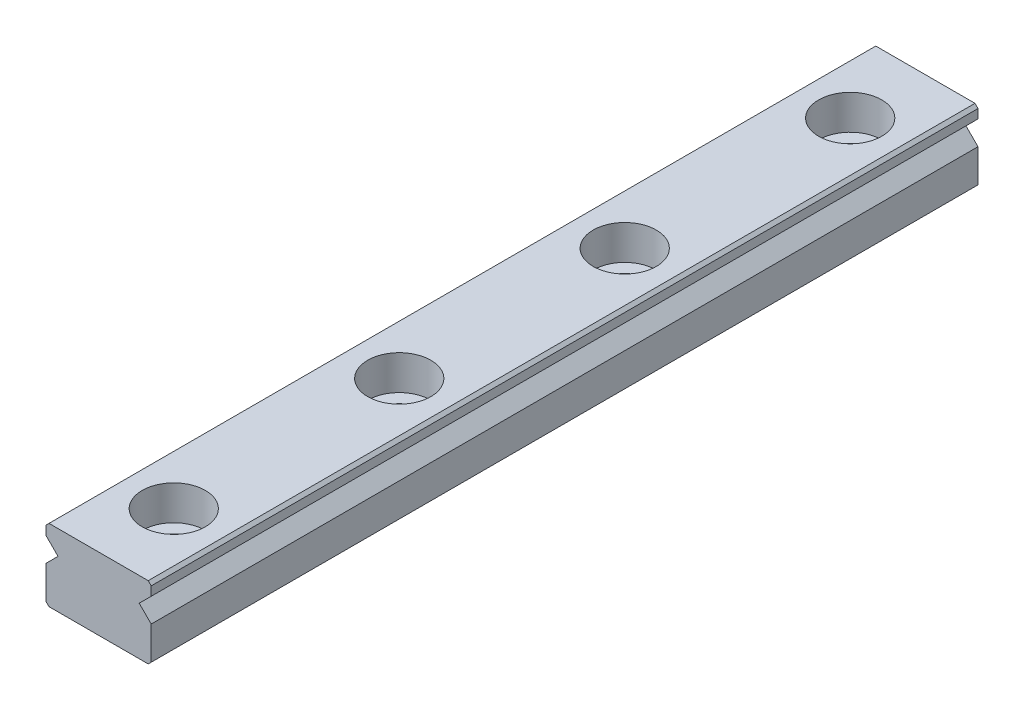
from build123d import *

# Parameters (mm, degrees)
EXTRUDE_1_DEPTH     = 55
SKETCH_2_R          = 2.1
CUT_EXTRUDE_1_DEPTH = 2.3
CHAMFER_1_SIZE      = 0.2
SKETCH_4_R          = 1.2
CUT_EXTRUDE_3_DEPTH = 56.167925464


with BuildPart() as part:
    # 草图1 → 凸台-拉伸1 (new body)
    with BuildSketch(Plane.XY):
        Polygon((-3.5, 0), (3.5, 0), (3.5, 2.4), (2.7, 3.2), (3.5, 4), (3.5, 4.8), (-3.5, 4.8), (-3.5, 4), (-2.7, 3.2), (-3.5, 2.4), align=None)
    extrude(amount=EXTRUDE_1_DEPTH)

    # 草图2 → 切除-拉伸1 (cut)
    with BuildSketch(Plane(origin=(0, 4.8, 0), x_dir=(1, 0, 0), z_dir=(0, 1, 0))):
        with Locations(Location((0, -5, 0), (0, 0, 180))):
            Circle(SKETCH_2_R)
        with Locations(Location((0, -20, 0), (0, 0, 180))):
            Circle(SKETCH_2_R)
        with Locations(Location((0, -35, 0), (0, 0, 180))):
            Circle(SKETCH_2_R)
        with Locations(Location((0, -50, 0), (0, 0, 180))):
            Circle(SKETCH_2_R)
    extrude(amount=-CUT_EXTRUDE_1_DEPTH, mode=Mode.SUBTRACT)

    # 倒角1
    chamfer_1_edges = [part.edges().sort_by_distance(p)[0] for p in [
        (-3.5, 4.8, 27.5),
        (3.5, 4.8, 27.5),
        (3.5, 0, 27.5),
        (-3.5, 0, 27.5),
    ]]
    chamfer(chamfer_1_edges, length=CHAMFER_1_SIZE)

    # 草图4 → 切除-拉伸3 (cut, through all)
    with BuildSketch(Plane(origin=(0, 2.5, 0), x_dir=(1, 0, 0), z_dir=(0, 1, 0))):
        with Locations(Location((0, -5, 0), (0, 0, 180))):
            Circle(SKETCH_4_R)
        with Locations(Location((0, -20, 0), (0, 0, 180))):
            Circle(SKETCH_4_R)
        with Locations(Location((0, -50, 0), (0, 0, 180))):
            Circle(SKETCH_4_R)
        with Locations(Location((0, -35, 0), (0, 0, 180))):
            Circle(SKETCH_4_R)
    extrude(amount=-CUT_EXTRUDE_3_DEPTH, mode=Mode.SUBTRACT)


solid = part.part
